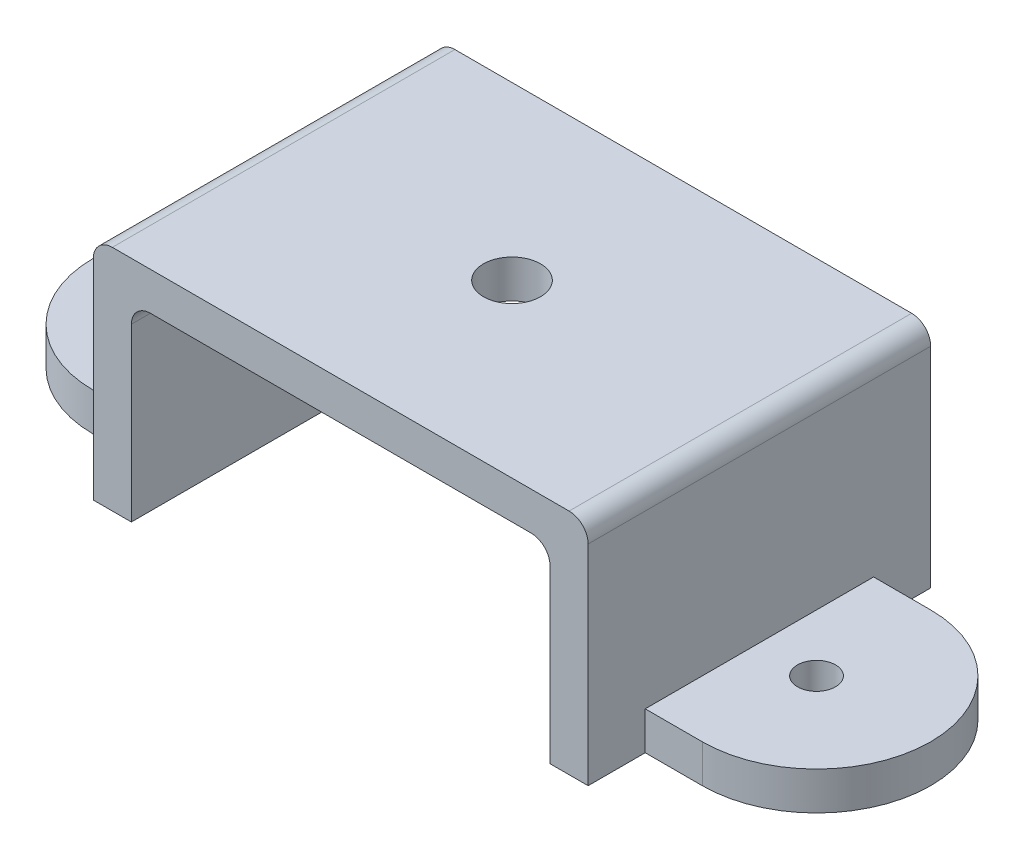
from build123d import *

# Parameters (mm, degrees)
BOSS_EXTRUDE1_DEPTH      = 12.7
BOSS_EXTRUDE2_DEPTH      = 57.15
BOSS_EXTRUDE2_DEPTH_BACK = 57.15
SKETCH8_R                = 9.525
CUT_EXTRUDE2_DEPTH       = 170.081792337
SKETCH9_W                = 139.7
SKETCH9_H                = 63.5
CUT_EXTRUDE3_DEPTH       = 196.926057481
FILLET1_R                = 6.35
SKETCH10_R               = 6.35
CUT_EXTRUDE4_DEPTH       = 164.751221369


with BuildPart() as part:
    # Sketch1 → Boss-Extrude1 (new body)
    with BuildSketch(Plane(origin=(0, 0, 0), x_dir=(1, 0, 0), z_dir=(0, 1, 0))):
        with BuildLine():
            Line((101.6, 38.1), (-101.6, 38.1))
            ThreePointArc((-101.6, 38.1), (-74.659231637, 26.940768363), (-63.5, 0))
            ThreePointArc((-63.5, 0), (-74.659231637, -26.940768363), (-101.6, -38.1))
            Line((-101.6, -38.1), (101.6, -38.1))
            ThreePointArc((101.6, -38.1), (63.5, 0), (101.6, 38.1))
        make_face()
        with BuildLine():
            ThreePointArc((-63.5, 0), (-74.659231637, 26.940768363), (-101.6, 38.1))
            Line((-101.6, 38.1), (-101.6, -38.1))
            ThreePointArc((-101.6, -38.1), (-74.659231637, -26.940768363), (-63.5, 0))
        make_face()
        with BuildLine():
            Line((-101.6, -38.1), (-101.6, 38.1))
            ThreePointArc((-101.6, 38.1), (-139.7, 0), (-101.6, -38.1))
        make_face()
        with BuildLine():
            ThreePointArc((139.7, 0), (128.540768363, 26.940768363), (101.6, 38.1))
            Line((101.6, 38.1), (101.6, -38.1))
            ThreePointArc((101.6, -38.1), (128.540768363, -26.940768363), (139.7, 0))
        make_face()
        with BuildLine():
            Line((101.6, -38.1), (101.6, 38.1))
            ThreePointArc((101.6, 38.1), (63.5, 0), (101.6, -38.1))
        make_face()
    extrude(amount=BOSS_EXTRUDE1_DEPTH)

    # Sketch2 → Boss-Extrude2 (add, two sides: drawn at the far end of the back side and taken through both)
    with BuildSketch(Plane.XY.offset(-BOSS_EXTRUDE2_DEPTH_BACK)):
        Polygon((69.85, 0), (69.85, 63.5), (-69.85, 63.5), (-69.85, 0), (-82.55, 0), (-82.55, 76.2), (82.55, 76.2), (82.55, 0), align=None)
    extrude(amount=BOSS_EXTRUDE2_DEPTH + BOSS_EXTRUDE2_DEPTH_BACK)

    # Sketch8 → Cut-Extrude2 (cut, through all)
    with BuildSketch(Plane(origin=(0, 0, 0), x_dir=(1, 0, 0), z_dir=(0, 1, 0))):
        with Locations(Location((0, 0, 0), (0, 0, 90))):
            Circle(SKETCH8_R)
    extrude(amount=CUT_EXTRUDE2_DEPTH, mode=Mode.SUBTRACT)

    # Sketch9 → Cut-Extrude3 (cut, through all)
    with BuildSketch(Plane.XY.offset(57.15)):
        with Locations((0, 31.75)):
            Rectangle(SKETCH9_W, SKETCH9_H)
    extrude(amount=-CUT_EXTRUDE3_DEPTH, mode=Mode.SUBTRACT)

    # Fillet1
    fillet1_edges = [part.edges().sort_by_distance(p)[0] for p in [
        (-69.85, 63.5, 0),
        (82.55, 76.2, 0),
        (69.85, 63.5, 0),
        (-82.55, 76.2, 0),
    ]]
    fillet(fillet1_edges, radius=FILLET1_R)

    # Sketch10 → Cut-Extrude4 (cut, through all)
    with BuildSketch(Plane(origin=(0, 12.7, 0), x_dir=(1, 0, 0), z_dir=(0, 1, 0))):
        with Locations(Location((101.6, 0, 0), (0, 0, 270))):
            Circle(SKETCH10_R)
        with Locations(Location((-101.6, 0, 0), (0, 0, 270))):
            Circle(SKETCH10_R)
    extrude(amount=-CUT_EXTRUDE4_DEPTH, mode=Mode.SUBTRACT)


solid = part.part
